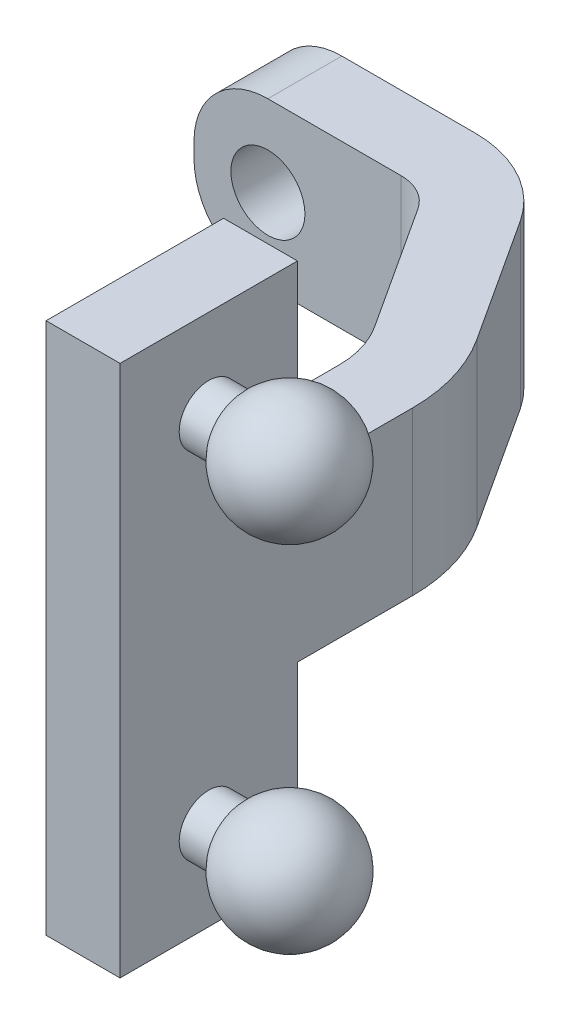
from build123d import *

# Parameters (mm, degrees)
EXTRUDE_1_DEPTH     = 2.75
SKETCH_2_R          = 1.25
CUT_EXTRUDE_1_DEPTH = 10
FILLET_2_R          = 2.5
SKETCH_4_W          = 6
SKETCH_4_H          = 18
EXTRUDE_2_DEPTH     = 2.5
SKETCH_5_R          = 1
EXTRUDE_3_DEPTH     = 1


with BuildPart() as part:
    # 草图1 → 凸台-拉伸1 (new, symmetric)
    with BuildSketch(Plane(origin=(0, 0, 0), x_dir=(1, 0, 0), z_dir=(0, 1, 0))):
        with BuildLine():
            Line((0, 0), (7, 0))
            ThreePointArc((7, 0), (8.907645559, -0.484194485), (10.353455389, -1.819555789))
            Line((10.353455389, -1.819555789), (13.08620622, -6.022441585))
            ThreePointArc((13.08620622, -6.022441585), (13.76673936, -7.496994372), (14, -9.104172255))
            Line((14, -9.104172255), (14, -19))
            Line((14, -19), (11.5, -19))
            Line((11.5, -19), (11.5, -9.104172255))
            ThreePointArc((11.5, -9.104172255), (11.369889965, -8.207707378), (10.990296602, -7.385219216))
            Line((10.990296602, -7.385219216), (8.257545771, -3.182333421))
            ThreePointArc((8.257545771, -3.182333421), (7.715367085, -2.681572932), (7, -2.5))
            Line((7, -2.5), (0, -2.5))
            Line((0, -2.5), (0, 0))
        make_face()
    extrude(amount=EXTRUDE_1_DEPTH, both=True)

    # 草图2 → 切除-拉伸1 (cut)
    with BuildSketch(Plane(origin=(0, 0, 0), x_dir=(-1, 0, 0), z_dir=(0, 0, -1))):
        with Locations((-2.5, 0)):
            Circle(SKETCH_2_R)
    extrude(amount=-CUT_EXTRUDE_1_DEPTH, mode=Mode.SUBTRACT)

    # 圆角2
    fillet_2_edges = [part.edges().sort_by_distance(p)[0] for p in [
        (0, -2.75, 1.25),
        (0, 2.75, 1.25),
    ]]
    fillet(fillet_2_edges, radius=FILLET_2_R)

    # 草图4 → 凸台-拉伸2 (add)
    with BuildSketch(Plane.ZY.offset(-11.5)):
        with Locations((16, 0)):
            Rectangle(SKETCH_4_W, SKETCH_4_H)
    extrude(amount=-EXTRUDE_2_DEPTH)

    # 草图5 → 凸台-拉伸3 (add)
    with BuildSketch(Plane(origin=(14, 0, 0), x_dir=(0, 0, -1), z_dir=(1, 0, 0))):
        with Locations(Location((-16, 6, 0), (0, 0, 180))):
            Circle(SKETCH_5_R)
    extrude_3 = extrude(amount=EXTRUDE_3_DEPTH)

    # 草图6 → 旋转1 (revolve)
    with BuildSketch(Plane(origin=(0, 0, 16), x_dir=(-1, 0, 0), z_dir=(0, 0, -1))):
        with BuildLine():
            Line((-15, 6), (-18.732050808, 6))
            ThreePointArc((-18.732050808, 6), (-17.249688898, 7.931851653), (-15, 7))
            Line((-15, 7), (-15, 6))
        make_face()
    revolve_1 = revolve(axis=Axis((15, 6, 16), (1, 0, 0)))

    # 镜向1: 凸台-拉伸3, 旋转1 across plane
    add(extrude_3.mirror(Plane.ZX))
    add(revolve_1.mirror(Plane.ZX))


solid = part.part
